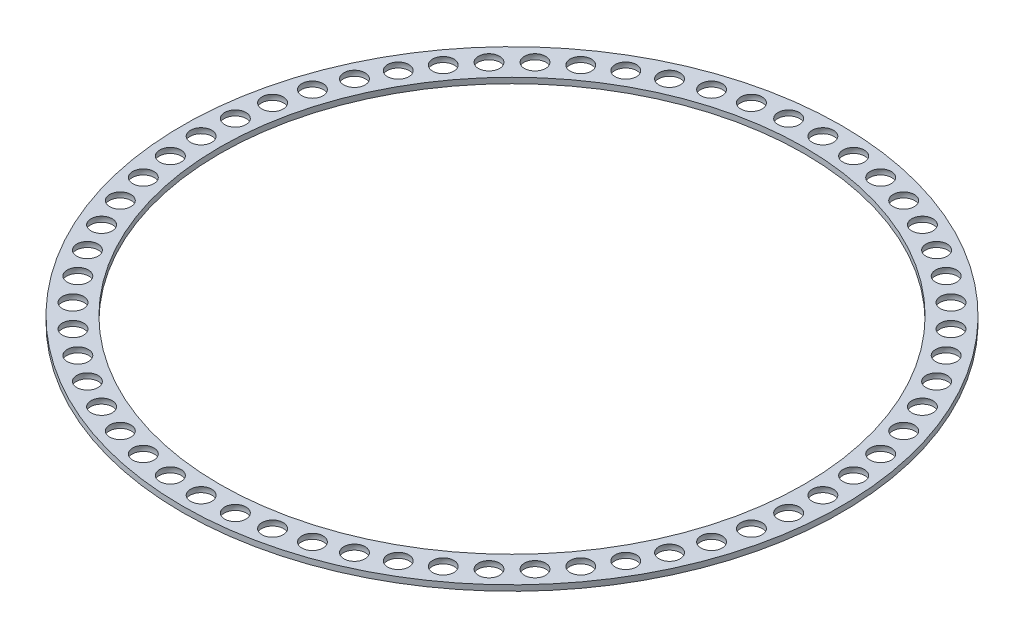
from build123d import *

# Parameters (mm, degrees)
SKETCH1_R           = 88.05
SKETCH1_R_2         = 78.05
BOSS_EXTRUDE1_DEPTH = 1.5
CIRPATTERN5_COUNT   = 60


with BuildPart() as part:
    # Sketch1 → Boss-Extrude1 (new body)
    with BuildSketch(Plane(origin=(0, 0, 0), x_dir=(1, 0, 0), z_dir=(0, 1, 0))):
        Circle(SKETCH1_R)
        Circle(SKETCH1_R_2, mode=Mode.SUBTRACT)
    extrude(amount=BOSS_EXTRUDE1_DEPTH)

    # Sketch2 → Cut-Revolve1 (revolve, cut)
    with BuildSketch(Plane.XY):
        with BuildLine():
            Line((83.05, 3.5), (83.05, -2.5))
            ThreePointArc((83.05, -2.5), (86.05, 0.5), (83.05, 3.5))
        make_face()
    cut_revolve1 = revolve(axis=Axis((83.05, -2.5, 0), (0, 1, 0)), mode=Mode.SUBTRACT)

    # CirPattern5: Cut-Revolve1 ×60 about axis
    cirpattern5_axis = Axis((0, 0, 0), (0, 1, 0))
    for i in range(1, CIRPATTERN5_COUNT):
        add(cut_revolve1.rotate(cirpattern5_axis, i * 360 / CIRPATTERN5_COUNT), mode=Mode.SUBTRACT)


solid = part.part
